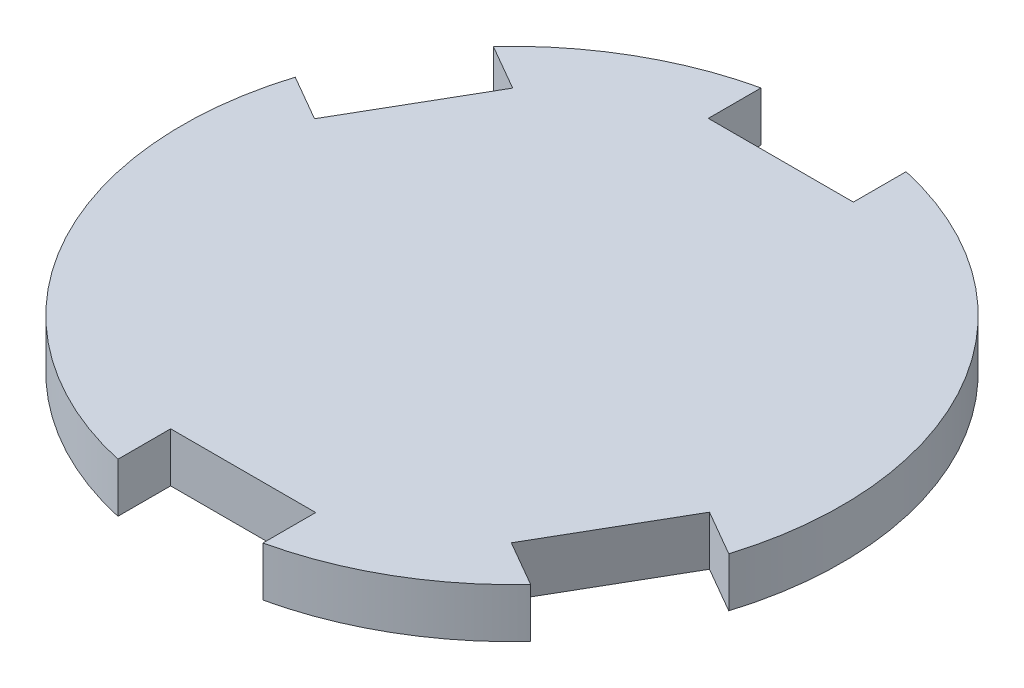
from build123d import *

# Parameters (mm, degrees)
SKETCH1_R           = 31.75
BOSS_EXTRUDE1_DEPTH = 4.7625
CUT_EXTRUDE1_REACH  = 47.153
CUT_EXTRUDE2_REACH  = 46.61


with BuildPart() as part:
    # Sketch1 → Boss-Extrude1 (new body)
    with BuildSketch(Plane(origin=(0, 0, 0), x_dir=(1, 0, 0), z_dir=(0, 1, 0))):
        with Locations(Location((0, 0, 0), (0, 0, 90))):
            Circle(SKETCH1_R)
    extrude(amount=BOSS_EXTRUDE1_DEPTH)

    # Sketch2 → Cut-Extrude1 (cut, up to next)
    with BuildSketch(Plane(origin=(0, 4.7625, 0), x_dir=(1, 0, 0), z_dir=(0, 1, 0)), mode=Mode.PRIVATE) as cut_extrude1_sk1:
        with BuildLine():
            Line((-6.985, -30.972120932), (-6.985, -25.892120932))
            Line((-6.985, -25.892120932), (6.985, -25.892120932))
            Line((6.985, -25.892120932), (6.985, -30.972120932))
            ThreePointArc((6.985, -30.972120932), (0, -31.75), (-6.985, -30.972120932))
        make_face()
    cut_extrude1_tool1 = extrude(cut_extrude1_sk1.sketch, amount=-CUT_EXTRUDE1_REACH, mode=Mode.PRIVATE) & part.part
    # Sketch2 → Cut-Extrude1 (cut, up to next)
    with BuildSketch(Plane(origin=(0, 4.7625, 0), x_dir=(1, 0, 0), z_dir=(0, 1, 0)), mode=Mode.PRIVATE) as cut_extrude1_sk2:
        with BuildLine():
            Line((-6.985, 30.972120932), (-6.985, 25.892120932))
            Line((-6.985, 25.892120932), (6.985, 25.892120932))
            Line((6.985, 25.892120932), (6.985, 30.972120932))
            ThreePointArc((6.985, 30.972120932), (0, 31.75), (-6.985, 30.972120932))
        make_face()
    cut_extrude1_tool2 = extrude(cut_extrude1_sk2.sketch, amount=-CUT_EXTRUDE1_REACH, mode=Mode.PRIVATE) & part.part
    add(cut_extrude1_tool1.solids().sort_by_distance((0, 4.7625, 28.696841))[0], mode=Mode.SUBTRACT)
    add(cut_extrude1_tool2.solids().sort_by_distance((0, 4.7625, -28.696841))[0], mode=Mode.SUBTRACT)

    # Sketch3 → Cut-Extrude2 (cut, up to next)
    with BuildSketch(Plane(origin=(0, 4.7625, 0), x_dir=(1, 0, 0), z_dir=(0, 1, 0)), mode=Mode.PRIVATE) as cut_extrude2_sk1:
        with BuildLine():
            Line((18.930734485, -18.995247911), (25.915734485, -6.89687302))
            Line((25.915734485, -6.89687302), (30.315143536, -9.43687302))
            ThreePointArc((30.315143536, -9.43687302), (27.49630657, -15.875), (23.330143536, -21.535247911))
            Line((23.330143536, -21.535247911), (18.930734485, -18.995247911))
        make_face()
    cut_extrude2_tool1 = extrude(cut_extrude2_sk1.sketch, amount=-CUT_EXTRUDE2_REACH, mode=Mode.PRIVATE) & part.part
    # Sketch3 → Cut-Extrude2 (cut, up to next)
    with BuildSketch(Plane(origin=(0, 4.7625, 0), x_dir=(1, 0, 0), z_dir=(0, 1, 0)), mode=Mode.PRIVATE) as cut_extrude2_sk2:
        with BuildLine():
            Line((-25.915734485, 6.89687302), (-30.315143536, 9.43687302))
            ThreePointArc((-30.315143536, 9.43687302), (-27.49630657, 15.875), (-23.330143536, 21.535247911))
            Line((-23.330143536, 21.535247911), (-18.930734485, 18.995247911))
            Line((-18.930734485, 18.995247911), (-25.915734485, 6.89687302))
        make_face()
    cut_extrude2_tool2 = extrude(cut_extrude2_sk2.sketch, amount=-CUT_EXTRUDE2_REACH, mode=Mode.PRIVATE) & part.part
    add(cut_extrude2_tool1.solids().sort_by_distance((24.852194, 4.7625, 14.348421))[0], mode=Mode.SUBTRACT)
    add(cut_extrude2_tool2.solids().sort_by_distance((-24.852194, 4.7625, -14.348421))[0], mode=Mode.SUBTRACT)


solid = part.part
